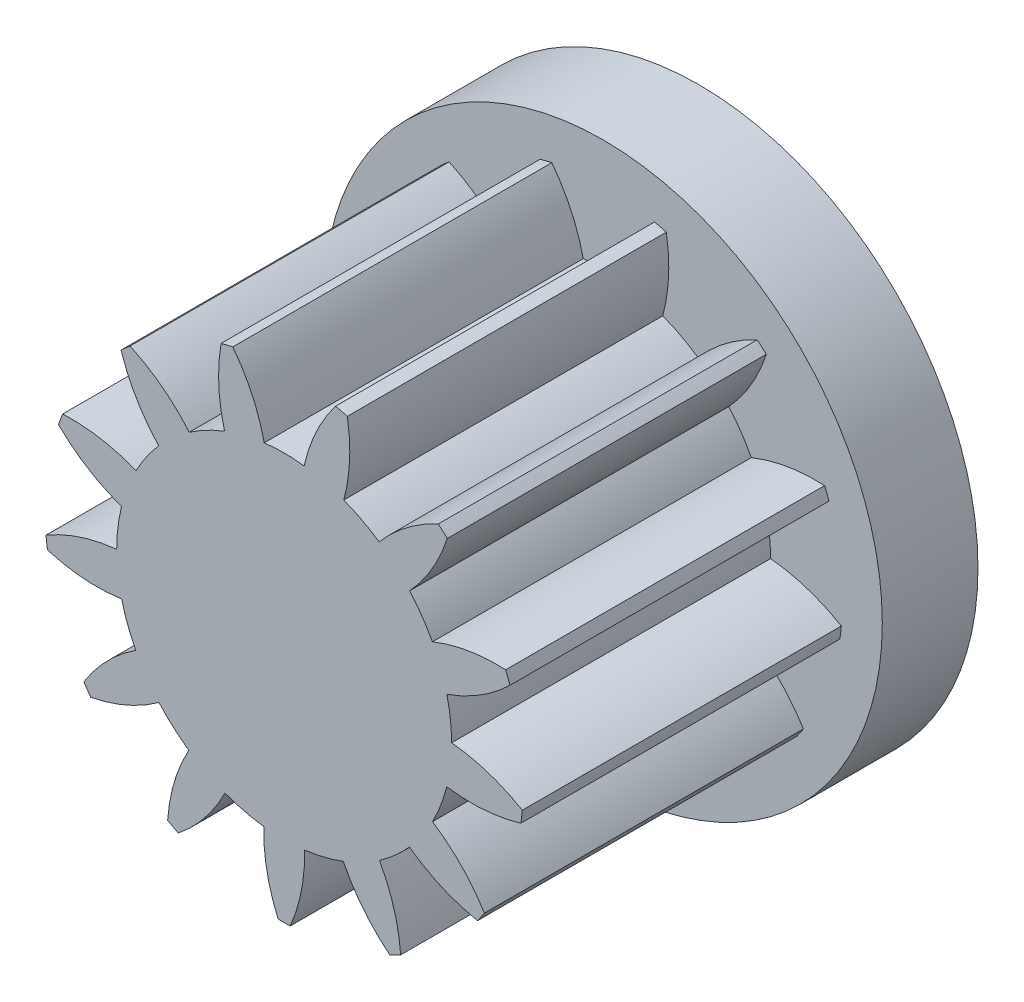
from build123d import *

# Parameters (mm, degrees)
SKETCH1_R           = 8.75
BOSS_EXTRUDE1_DEPTH = 3
BOSS_EXTRUDE2_DEPTH = 10
SCALE1_SCALE        = 1.9


with BuildPart() as part:
    # Sketch1 → Boss-Extrude1 (new body)
    with BuildSketch(Plane.XY):
        Circle(SKETCH1_R)
    extrude(amount=BOSS_EXTRUDE1_DEPTH)

    # Sketch2 → Boss-Extrude2 (add)
    with BuildSketch(Plane.XY.offset(3)):
        with BuildLine():
            ThreePointArc((4.829991895, 5.737697996), (3.826186326, 5.132311911), (2.976672459, 4.324571779))
            ThreePointArc((2.976672459, 4.324571779), (2.440108702, 4.648480345), (1.868768811, 4.906139331))
            ThreePointArc((1.868768811, 4.906139331), (2.051102492, 6.064099762), (1.979255999, 7.234123699))
            ThreePointArc((1.979255999, 7.234123699), (1.795356309, 7.281943128), (1.610304214, 7.325088418))
            ThreePointArc((1.610304214, 7.325088418), (1.002815466, 6.322553954), (0.62598385, 5.212546807))
            ThreePointArc((0.62598385, 5.212546807), (0.000352422, 5.249999988), (-0.625284028, 5.212630803))
            ThreePointArc((-0.625284028, 5.212630803), (-1.001966616, 6.322688531), (-1.609320762, 7.325304546))
            ThreePointArc((-1.609320762, 7.325304546), (-1.794378647, 7.2821841), (-1.978284756, 7.234389361))
            ThreePointArc((-1.978284756, 7.234389361), (-2.050288332, 6.06437508), (-1.868110115, 4.90639018))
            ThreePointArc((-1.868110115, 4.90639018), (-2.439484593, 4.648807903), (-2.976091832, 4.324971377))
            ThreePointArc((-2.976091832, 4.324971377), (-3.825497247, 5.132825554), (-4.82922153, 5.738346401))
            ThreePointArc((-4.82922153, 5.738346401), (-4.97304308, 5.614164455), (-5.113672529, 5.486378884))
            ThreePointArc((-5.113672529, 5.486378884), (-4.633695781, 4.41692096), (-3.934242565, 3.476238691))
            ThreePointArc((-3.934242565, 3.476238691), (-4.320465088, 2.982629951), (-4.645112863, 2.44651313))
            ThreePointArc((-4.645112863, 2.44651313), (-5.772652562, 2.7670941), (-6.942805845, 2.83680225))
            ThreePointArc((-6.942805845, 2.83680225), (-7.012443275, 2.66000739), (-7.077579552, 2.481505124))
            ThreePointArc((-7.077579552, 2.481505124), (-6.15557937, 1.757603477), (-5.099087457, 1.249722811))
            ThreePointArc((-5.099087457, 1.249722811), (-5.211679097, 0.633167423), (-5.249994516, 0.007588209))
            ThreePointArc((-5.249994516, 0.007588209), (-6.397362742, -0.232545265), (-7.46587701, -0.71461911))
            ThreePointArc((-7.46587701, -0.71461911), (-7.445377224, -0.90352531), (-7.420098394, -1.091851556))
            ThreePointArc((-7.420098394, -1.091851556), (-6.267293907, -1.304359781), (-5.095792863, -1.263089504))
            ThreePointArc((-5.095792863, -1.263089504), (-4.908960234, -1.861346132), (-4.652165695, -2.43307508))
            ThreePointArc((-4.652165695, -2.43307508), (-5.556514215, -3.178911313), (-6.278605726, -4.102329843))
            ThreePointArc((-6.278605726, -4.102329843), (-6.172664978, -4.260071251), (-6.062762116, -4.415078202))
            ThreePointArc((-6.062762116, -4.415078202), (-4.94324694, -4.067509932), (-3.925113535, -3.486543236))
            ThreePointArc((-3.925113535, -3.486543236), (-3.48165774, -3.92944772), (-2.988581778, -4.316350189))
            ThreePointArc((-2.988581778, -4.316350189), (-3.442735244, -5.397027088), (-3.652981535, -6.550246247))
            ThreePointArc((-3.652981535, -6.550246247), (-3.485869574, -6.640686208), (-3.316520101, -6.726863639))
            ThreePointArc((-3.316520101, -6.726863639), (-2.486761671, -5.898842577), (-1.855237999, -4.91127193))
            ThreePointArc((-1.855237999, -4.91127193), (-1.256749416, -5.09736019), (-0.640349792, -5.210801488))
            ThreePointArc((-0.640349792, -5.210801488), (-0.540267119, -6.378748999), (-0.190503298, -7.497580176))
            ThreePointArc((-0.190503298, -7.497580176), (-0.00050346, -7.499999983), (0.189496701, -7.497605685))
            ThreePointArc((0.189496701, -7.497605685), (0.539410728, -6.378821476), (0.639650205, -5.210887412))
            ThreePointArc((0.639650205, -5.210887412), (1.256065053, -5.09752887), (1.854578614, -4.911520962))
            ThreePointArc((1.854578614, -4.911520962), (2.485969693, -5.899176387), (3.315616949, -6.727308842))
            ThreePointArc((3.315616949, -6.727308842), (3.48497799, -6.641154147), (3.652102092, -6.550736623))
            ThreePointArc((3.652102092, -6.550736623), (3.44201063, -5.397489248), (2.988002255, -4.316751385))
            ThreePointArc((2.988002255, -4.316751385), (3.481130156, -3.929915118), (3.92464541, -3.487070175))
            ThreePointArc((3.92464541, -3.487070175), (4.942700807, -4.068173557), (6.06216931, -4.415892125))
            ThreePointArc((6.06216931, -4.415892125), (6.172092982, -4.260899931), (6.278054907, -4.103172747))
            ThreePointArc((6.278054907, -4.103172747), (5.556087377, -3.17965728), (4.651838998, -2.433699639))
            ThreePointArc((4.651838998, -2.433699639), (4.908710292, -1.862005173), (5.09562324, -1.263773634))
            ThreePointArc((5.09562324, -1.263773634), (6.267118732, -1.305201192), (7.41995174, -1.092847739))
            ThreePointArc((7.41995174, -1.092847739), (7.445255854, -0.904524889), (7.465781001, -0.715621443))
            ThreePointArc((7.465781001, -0.715621443), (6.397331464, -0.233404148), (5.249995488, 0.006883365))
            ThreePointArc((5.249995488, 0.006883365), (5.211764057, 0.632467717), (5.099255194, 1.249038216))
            ThreePointArc((5.099255194, 1.249038216), (6.155815283, 1.756777037), (7.077912646, 2.480554893))
            ThreePointArc((7.077912646, 2.480554893), (7.012800334, 2.659065903), (6.94318664, 2.83587011))
            ThreePointArc((6.94318664, 2.83587011), (5.773024009, 2.766319061), (4.64544128, 2.445889473))
            ThreePointArc((4.64544128, 2.445889473), (4.320865485, 2.982049876), (3.934709236, 3.475710464))
            ThreePointArc((3.934709236, 3.475710464), (4.634288738, 4.416298818), (5.114409063, 5.485692293))
            ThreePointArc((5.114409063, 5.485692293), (4.973796771, 5.613496743), (4.829991895, 5.737697996))
        make_face()
    extrude(amount=BOSS_EXTRUDE2_DEPTH)


with BuildPart() as part_1:
    # Scale1: scaled about (0, 0, 5.507121535)
    add(part.part.scale(SCALE1_SCALE).moved(Location((0, 0, -4.956409381))))


solid = part_1.part
